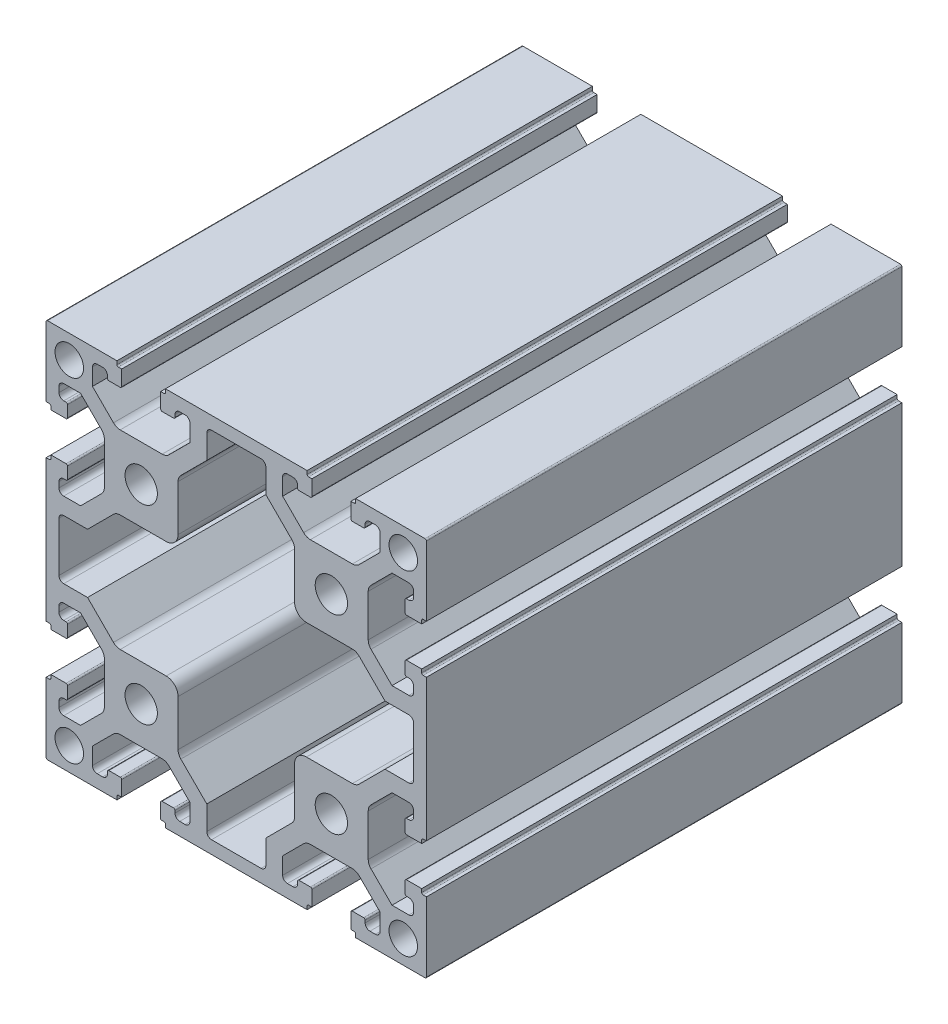
from build123d import *

# Parameters (mm, degrees)
SKETCH_1_R      = 3.4
SKETCH_1_R_2    = 3
EXTRUDE_1_DEPTH = 100


with BuildPart() as part:
    # 草图1 → 凸台-拉伸1 (new body)
    with BuildSketch(Plane.XY):
        with BuildLine():
            Line((-25.582808051, 38.637377279), (-40.182808051, 38.637377279))
            ThreePointArc((-40.182808051, 38.637377279), (-40.394940085, 38.549509313), (-40.482808051, 38.337377279))
            Line((-40.482808051, 38.337377279), (-40.482808051, 23.737377279))
            Line((-40.482808051, 23.737377279), (-39.782808051, 23.737377279))
            ThreePointArc((-39.782808051, 23.737377279), (-39.570676016, 23.649509313), (-39.482808051, 23.437377279))
            Line((-39.482808051, 23.437377279), (-39.482808051, 22.737377279))
            Line((-39.482808051, 22.737377279), (-36.282808051, 22.737377279))
            ThreePointArc((-36.282808051, 22.737377279), (-36.070676016, 22.825245245), (-35.982808051, 23.037377279))
            Line((-35.982808051, 23.037377279), (-35.982808051, 25.437377279))
            ThreePointArc((-35.982808051, 25.437377279), (-36.070676016, 25.649509313), (-36.282808051, 25.737377279))
            Line((-36.282808051, 25.737377279), (-36.782808051, 25.737377279))
            ThreePointArc((-36.782808051, 25.737377279), (-37.489914832, 26.030270498), (-37.782808051, 26.737377279))
            Line((-37.782808051, 26.737377279), (-37.782808051, 27.887377279))
            ThreePointArc((-37.782808051, 27.887377279), (-37.489914832, 28.59448406), (-36.782808051, 28.887377279))
            Line((-36.782808051, 28.887377279), (-33.235966056, 28.887377279))
            Line((-33.235966056, 28.887377279), (-28.818594488, 24.470005711))
            ThreePointArc((-28.818594488, 24.470005711), (-28.385048986, 23.821159014), (-28.232808051, 23.055792149))
            Line((-28.232808051, 23.055792149), (-28.232808051, 14.218962409))
            ThreePointArc((-28.232808051, 14.218962409), (-28.385048986, 13.453595545), (-28.818594488, 12.804748847))
            Line((-28.818594488, 12.804748847), (-33.235966056, 8.387377279))
            Line((-33.235966056, 8.387377279), (-36.782808051, 8.387377279))
            ThreePointArc((-36.782808051, 8.387377279), (-37.489914832, 8.680270498), (-37.782808051, 9.387377279))
            Line((-37.782808051, 9.387377279), (-37.782808051, 10.537377279))
            ThreePointArc((-37.782808051, 10.537377279), (-37.489914832, 11.24448406), (-36.782808051, 11.537377279))
            Line((-36.782808051, 11.537377279), (-36.282808051, 11.537377279))
            ThreePointArc((-36.282808051, 11.537377279), (-36.070676016, 11.625245245), (-35.982808051, 11.837377279))
            Line((-35.982808051, 11.837377279), (-35.982808051, 14.237377279))
            ThreePointArc((-35.982808051, 14.237377279), (-36.070676016, 14.449509313), (-36.282808051, 14.537377279))
            Line((-36.282808051, 14.537377279), (-39.482808051, 14.537377279))
            Line((-39.482808051, 14.537377279), (-39.482808051, 13.837377279))
            ThreePointArc((-39.482808051, 13.837377279), (-39.570676016, 13.625245245), (-39.782808051, 13.537377279))
            Line((-39.782808051, 13.537377279), (-40.482808051, 13.537377279))
            Line((-40.482808051, 13.537377279), (-40.482808051, 3.137377279))
            Line((-40.482808051, 3.137377279), (-40.482808051, -5.862622721))
            Line((-40.482808051, -5.862622721), (-40.482808051, -16.262622721))
            Line((-40.482808051, -16.262622721), (-39.782808051, -16.262622721))
            ThreePointArc((-39.782808051, -16.262622721), (-39.570676016, -16.350490687), (-39.482808051, -16.562622721))
            Line((-39.482808051, -16.562622721), (-39.482808051, -17.262622721))
            Line((-39.482808051, -17.262622721), (-36.282808051, -17.262622721))
            ThreePointArc((-36.282808051, -17.262622721), (-36.070676016, -17.174754755), (-35.982808051, -16.962622721))
            Line((-35.982808051, -16.962622721), (-35.982808051, -14.562622721))
            ThreePointArc((-35.982808051, -14.562622721), (-36.070676016, -14.350490687), (-36.282808051, -14.262622721))
            Line((-36.282808051, -14.262622721), (-36.782808051, -14.262622721))
            ThreePointArc((-36.782808051, -14.262622721), (-37.489914832, -13.969729502), (-37.782808051, -13.262622721))
            Line((-37.782808051, -13.262622721), (-37.782808051, -12.112622721))
            ThreePointArc((-37.782808051, -12.112622721), (-37.489914832, -11.40551594), (-36.782808051, -11.112622721))
            Line((-36.782808051, -11.112622721), (-33.235966056, -11.112622721))
            Line((-33.235966056, -11.112622721), (-28.818594488, -15.529994289))
            ThreePointArc((-28.818594488, -15.529994289), (-28.385048986, -16.178840986), (-28.232808051, -16.944207851))
            Line((-28.232808051, -16.944207851), (-28.232808051, -25.781037591))
            ThreePointArc((-28.232808051, -25.781037591), (-28.385048986, -26.546404455), (-28.818594488, -27.195251153))
            Line((-28.818594488, -27.195251153), (-33.235966056, -31.612622721))
            Line((-33.235966056, -31.612622721), (-36.782808051, -31.612622721))
            ThreePointArc((-36.782808051, -31.612622721), (-37.489914832, -31.319729502), (-37.782808051, -30.612622721))
            Line((-37.782808051, -30.612622721), (-37.782808051, -29.462622721))
            ThreePointArc((-37.782808051, -29.462622721), (-37.489914832, -28.75551594), (-36.782808051, -28.462622721))
            Line((-36.782808051, -28.462622721), (-36.282808051, -28.462622721))
            ThreePointArc((-36.282808051, -28.462622721), (-36.070676016, -28.374754755), (-35.982808051, -28.162622721))
            Line((-35.982808051, -28.162622721), (-35.982808051, -25.762622721))
            ThreePointArc((-35.982808051, -25.762622721), (-36.070676016, -25.550490687), (-36.282808051, -25.462622721))
            Line((-36.282808051, -25.462622721), (-39.482808051, -25.462622721))
            Line((-39.482808051, -25.462622721), (-39.482808051, -26.162622721))
            ThreePointArc((-39.482808051, -26.162622721), (-39.570676016, -26.374754755), (-39.782808051, -26.462622721))
            Line((-39.782808051, -26.462622721), (-40.482808051, -26.462622721))
            Line((-40.482808051, -26.462622721), (-40.482808051, -41.062622721))
            ThreePointArc((-40.482808051, -41.062622721), (-40.394940085, -41.274754755), (-40.182808051, -41.362622721))
            Line((-40.182808051, -41.362622721), (-25.582808051, -41.362622721))
            Line((-25.582808051, -41.362622721), (-25.582808051, -40.662622721))
            ThreePointArc((-25.582808051, -40.662622721), (-25.494940085, -40.450490687), (-25.282808051, -40.362622721))
            Line((-25.282808051, -40.362622721), (-24.582808051, -40.362622721))
            Line((-24.582808051, -40.362622721), (-24.582808051, -37.162622721))
            ThreePointArc((-24.582808051, -37.162622721), (-24.670676016, -36.950490687), (-24.882808051, -36.862622721))
            Line((-24.882808051, -36.862622721), (-27.282808051, -36.862622721))
            ThreePointArc((-27.282808051, -36.862622721), (-27.494940085, -36.950490687), (-27.582808051, -37.162622721))
            Line((-27.582808051, -37.162622721), (-27.582808051, -37.662622721))
            ThreePointArc((-27.582808051, -37.662622721), (-27.875701269, -38.369729502), (-28.582808051, -38.662622721))
            Line((-28.582808051, -38.662622721), (-29.732808051, -38.662622721))
            ThreePointArc((-29.732808051, -38.662622721), (-30.439914832, -38.369729502), (-30.732808051, -37.662622721))
            Line((-30.732808051, -37.662622721), (-30.732808051, -34.115780726))
            Line((-30.732808051, -34.115780726), (-26.315436483, -29.698409159))
            ThreePointArc((-26.315436483, -29.698409159), (-25.666589785, -29.264863656), (-24.90122292, -29.112622721))
            Line((-24.90122292, -29.112622721), (-16.064393181, -29.112622721))
            ThreePointArc((-16.064393181, -29.112622721), (-15.299026316, -29.264863656), (-14.650179618, -29.698409159))
            Line((-14.650179618, -29.698409159), (-10.232808051, -34.115780726))
            Line((-10.232808051, -34.115780726), (-10.232808051, -37.662622721))
            ThreePointArc((-10.232808051, -37.662622721), (-10.525701269, -38.369729502), (-11.232808051, -38.662622721))
            Line((-11.232808051, -38.662622721), (-12.382808051, -38.662622721))
            ThreePointArc((-12.382808051, -38.662622721), (-13.089914832, -38.369729502), (-13.382808051, -37.662622721))
            Line((-13.382808051, -37.662622721), (-13.382808051, -37.162622721))
            ThreePointArc((-13.382808051, -37.162622721), (-13.470676016, -36.950490687), (-13.682808051, -36.862622721))
            Line((-13.682808051, -36.862622721), (-16.082808051, -36.862622721))
            ThreePointArc((-16.082808051, -36.862622721), (-16.294940085, -36.950490687), (-16.382808051, -37.162622721))
            Line((-16.382808051, -37.162622721), (-16.382808051, -40.362622721))
            Line((-16.382808051, -40.362622721), (-15.682808051, -40.362622721))
            ThreePointArc((-15.682808051, -40.362622721), (-15.470676016, -40.450490687), (-15.382808051, -40.662622721))
            Line((-15.382808051, -40.662622721), (-15.382808051, -41.362622721))
            Line((-15.382808051, -41.362622721), (-4.982808051, -41.362622721))
            Line((-4.982808051, -41.362622721), (4.017191949, -41.362622721))
            Line((4.017191949, -41.362622721), (14.417191949, -41.362622721))
            Line((14.417191949, -41.362622721), (14.417191949, -40.662622721))
            ThreePointArc((14.417191949, -40.662622721), (14.505059915, -40.450490687), (14.717191949, -40.362622721))
            Line((14.717191949, -40.362622721), (15.417191949, -40.362622721))
            Line((15.417191949, -40.362622721), (15.417191949, -37.162622721))
            ThreePointArc((15.417191949, -37.162622721), (15.329323984, -36.950490687), (15.117191949, -36.862622721))
            Line((15.117191949, -36.862622721), (12.717191949, -36.862622721))
            ThreePointArc((12.717191949, -36.862622721), (12.505059915, -36.950490687), (12.417191949, -37.162622721))
            Line((12.417191949, -37.162622721), (12.417191949, -37.662622721))
            ThreePointArc((12.417191949, -37.662622721), (12.124298731, -38.369729502), (11.417191949, -38.662622721))
            Line((11.417191949, -38.662622721), (10.267191949, -38.662622721))
            ThreePointArc((10.267191949, -38.662622721), (9.560085168, -38.369729502), (9.267191949, -37.662622721))
            Line((9.267191949, -37.662622721), (9.267191949, -34.115780726))
            Line((9.267191949, -34.115780726), (13.684563517, -29.698409159))
            ThreePointArc((13.684563517, -29.698409159), (14.333410215, -29.264863656), (15.09877708, -29.112622721))
            Line((15.09877708, -29.112622721), (23.935606819, -29.112622721))
            ThreePointArc((23.935606819, -29.112622721), (24.700973684, -29.264863656), (25.349820382, -29.698409159))
            Line((25.349820382, -29.698409159), (29.767191949, -34.115780726))
            Line((29.767191949, -34.115780726), (29.767191949, -37.662622721))
            ThreePointArc((29.767191949, -37.662622721), (29.474298731, -38.369729502), (28.767191949, -38.662622721))
            Line((28.767191949, -38.662622721), (27.617191949, -38.662622721))
            ThreePointArc((27.617191949, -38.662622721), (26.910085168, -38.369729502), (26.617191949, -37.662622721))
            Line((26.617191949, -37.662622721), (26.617191949, -37.162622721))
            ThreePointArc((26.617191949, -37.162622721), (26.529323984, -36.950490687), (26.317191949, -36.862622721))
            Line((26.317191949, -36.862622721), (23.917191949, -36.862622721))
            ThreePointArc((23.917191949, -36.862622721), (23.705059915, -36.950490687), (23.617191949, -37.162622721))
            Line((23.617191949, -37.162622721), (23.617191949, -40.362622721))
            Line((23.617191949, -40.362622721), (24.317191949, -40.362622721))
            ThreePointArc((24.317191949, -40.362622721), (24.529323984, -40.450490687), (24.617191949, -40.662622721))
            Line((24.617191949, -40.662622721), (24.617191949, -41.362622721))
            Line((24.617191949, -41.362622721), (39.217191949, -41.362622721))
            ThreePointArc((39.217191949, -41.362622721), (39.429323984, -41.274754755), (39.517191949, -41.062622721))
            Line((39.517191949, -41.062622721), (39.517191949, -26.462622721))
            Line((39.517191949, -26.462622721), (38.817191949, -26.462622721))
            ThreePointArc((38.817191949, -26.462622721), (38.605059915, -26.374754755), (38.517191949, -26.162622721))
            Line((38.517191949, -26.162622721), (38.517191949, -25.462622721))
            Line((38.517191949, -25.462622721), (35.317191949, -25.462622721))
            ThreePointArc((35.317191949, -25.462622721), (35.105059915, -25.550490687), (35.017191949, -25.762622721))
            Line((35.017191949, -25.762622721), (35.017191949, -28.162622721))
            ThreePointArc((35.017191949, -28.162622721), (35.105059915, -28.374754755), (35.317191949, -28.462622721))
            Line((35.317191949, -28.462622721), (35.817191949, -28.462622721))
            ThreePointArc((35.817191949, -28.462622721), (36.524298731, -28.75551594), (36.817191949, -29.462622721))
            Line((36.817191949, -29.462622721), (36.817191949, -30.612622721))
            ThreePointArc((36.817191949, -30.612622721), (36.524298731, -31.319729502), (35.817191949, -31.612622721))
            Line((35.817191949, -31.612622721), (32.270349955, -31.612622721))
            Line((32.270349955, -31.612622721), (27.852978387, -27.195251153))
            ThreePointArc((27.852978387, -27.195251153), (27.419432884, -26.546404455), (27.267191949, -25.781037591))
            Line((27.267191949, -25.781037591), (27.267191949, -16.944207851))
            ThreePointArc((27.267191949, -16.944207851), (27.419432884, -16.178840986), (27.852978387, -15.529994289))
            Line((27.852978387, -15.529994289), (32.270349955, -11.112622721))
            Line((32.270349955, -11.112622721), (35.817191949, -11.112622721))
            ThreePointArc((35.817191949, -11.112622721), (36.524298731, -11.40551594), (36.817191949, -12.112622721))
            Line((36.817191949, -12.112622721), (36.817191949, -13.262622721))
            ThreePointArc((36.817191949, -13.262622721), (36.524298731, -13.969729502), (35.817191949, -14.262622721))
            Line((35.817191949, -14.262622721), (35.317191949, -14.262622721))
            ThreePointArc((35.317191949, -14.262622721), (35.105059915, -14.350490687), (35.017191949, -14.562622721))
            Line((35.017191949, -14.562622721), (35.017191949, -16.962622721))
            ThreePointArc((35.017191949, -16.962622721), (35.105059915, -17.174754755), (35.317191949, -17.262622721))
            Line((35.317191949, -17.262622721), (38.517191949, -17.262622721))
            Line((38.517191949, -17.262622721), (38.517191949, -16.562622721))
            ThreePointArc((38.517191949, -16.562622721), (38.605059915, -16.350490687), (38.817191949, -16.262622721))
            Line((38.817191949, -16.262622721), (39.517191949, -16.262622721))
            Line((39.517191949, -16.262622721), (39.517191949, -5.862622721))
            Line((39.517191949, -5.862622721), (39.517191949, 3.137377279))
            Line((39.517191949, 3.137377279), (39.517191949, 13.537377279))
            Line((39.517191949, 13.537377279), (38.817191949, 13.537377279))
            ThreePointArc((38.817191949, 13.537377279), (38.605059915, 13.625245245), (38.517191949, 13.837377279))
            Line((38.517191949, 13.837377279), (38.517191949, 14.537377279))
            Line((38.517191949, 14.537377279), (35.317191949, 14.537377279))
            ThreePointArc((35.317191949, 14.537377279), (35.105059915, 14.449509313), (35.017191949, 14.237377279))
            Line((35.017191949, 14.237377279), (35.017191949, 11.837377279))
            ThreePointArc((35.017191949, 11.837377279), (35.105059915, 11.625245245), (35.317191949, 11.537377279))
            Line((35.317191949, 11.537377279), (35.817191949, 11.537377279))
            ThreePointArc((35.817191949, 11.537377279), (36.524298731, 11.24448406), (36.817191949, 10.537377279))
            Line((36.817191949, 10.537377279), (36.817191949, 9.387377279))
            ThreePointArc((36.817191949, 9.387377279), (36.524298731, 8.680270498), (35.817191949, 8.387377279))
            Line((35.817191949, 8.387377279), (32.270349955, 8.387377279))
            Line((32.270349955, 8.387377279), (27.852978387, 12.804748847))
            ThreePointArc((27.852978387, 12.804748847), (27.419432884, 13.453595545), (27.267191949, 14.218962409))
            Line((27.267191949, 14.218962409), (27.267191949, 23.055792149))
            ThreePointArc((27.267191949, 23.055792149), (27.419432884, 23.821159014), (27.852978387, 24.470005711))
            Line((27.852978387, 24.470005711), (32.270349955, 28.887377279))
            Line((32.270349955, 28.887377279), (35.817191949, 28.887377279))
            ThreePointArc((35.817191949, 28.887377279), (36.524298731, 28.59448406), (36.817191949, 27.887377279))
            Line((36.817191949, 27.887377279), (36.817191949, 26.737377279))
            ThreePointArc((36.817191949, 26.737377279), (36.524298731, 26.030270498), (35.817191949, 25.737377279))
            Line((35.817191949, 25.737377279), (35.317191949, 25.737377279))
            ThreePointArc((35.317191949, 25.737377279), (35.105059915, 25.649509313), (35.017191949, 25.437377279))
            Line((35.017191949, 25.437377279), (35.017191949, 23.037377279))
            ThreePointArc((35.017191949, 23.037377279), (35.105059915, 22.825245245), (35.317191949, 22.737377279))
            Line((35.317191949, 22.737377279), (38.517191949, 22.737377279))
            Line((38.517191949, 22.737377279), (38.517191949, 23.437377279))
            ThreePointArc((38.517191949, 23.437377279), (38.605059915, 23.649509313), (38.817191949, 23.737377279))
            Line((38.817191949, 23.737377279), (39.517191949, 23.737377279))
            Line((39.517191949, 23.737377279), (39.517191949, 38.337377279))
            ThreePointArc((39.517191949, 38.337377279), (39.429323984, 38.549509313), (39.217191949, 38.637377279))
            Line((39.217191949, 38.637377279), (24.617191949, 38.637377279))
            Line((24.617191949, 38.637377279), (24.617191949, 37.937377279))
            ThreePointArc((24.617191949, 37.937377279), (24.529323984, 37.725245245), (24.317191949, 37.637377279))
            Line((24.317191949, 37.637377279), (23.617191949, 37.637377279))
            Line((23.617191949, 37.637377279), (23.617191949, 34.437377279))
            ThreePointArc((23.617191949, 34.437377279), (23.705059915, 34.225245245), (23.917191949, 34.137377279))
            Line((23.917191949, 34.137377279), (26.317191949, 34.137377279))
            ThreePointArc((26.317191949, 34.137377279), (26.529323984, 34.225245245), (26.617191949, 34.437377279))
            Line((26.617191949, 34.437377279), (26.617191949, 34.937377279))
            ThreePointArc((26.617191949, 34.937377279), (26.910085168, 35.64448406), (27.617191949, 35.937377279))
            Line((27.617191949, 35.937377279), (28.767191949, 35.937377279))
            ThreePointArc((28.767191949, 35.937377279), (29.474298731, 35.64448406), (29.767191949, 34.937377279))
            Line((29.767191949, 34.937377279), (29.767191949, 31.390535285))
            Line((29.767191949, 31.390535285), (25.349820382, 26.973163717))
            ThreePointArc((25.349820382, 26.973163717), (24.700973684, 26.539618214), (23.935606819, 26.387377279))
            Line((23.935606819, 26.387377279), (15.09877708, 26.387377279))
            ThreePointArc((15.09877708, 26.387377279), (14.333410215, 26.539618214), (13.684563517, 26.973163717))
            Line((13.684563517, 26.973163717), (9.267191949, 31.390535285))
            Line((9.267191949, 31.390535285), (9.267191949, 34.937377279))
            ThreePointArc((9.267191949, 34.937377279), (9.560085168, 35.64448406), (10.267191949, 35.937377279))
            Line((10.267191949, 35.937377279), (11.417191949, 35.937377279))
            ThreePointArc((11.417191949, 35.937377279), (12.124298731, 35.64448406), (12.417191949, 34.937377279))
            Line((12.417191949, 34.937377279), (12.417191949, 34.437377279))
            ThreePointArc((12.417191949, 34.437377279), (12.505059915, 34.225245245), (12.717191949, 34.137377279))
            Line((12.717191949, 34.137377279), (15.117191949, 34.137377279))
            ThreePointArc((15.117191949, 34.137377279), (15.329323984, 34.225245245), (15.417191949, 34.437377279))
            Line((15.417191949, 34.437377279), (15.417191949, 37.637377279))
            Line((15.417191949, 37.637377279), (14.717191949, 37.637377279))
            ThreePointArc((14.717191949, 37.637377279), (14.505059915, 37.725245245), (14.417191949, 37.937377279))
            Line((14.417191949, 37.937377279), (14.417191949, 38.637377279))
            Line((14.417191949, 38.637377279), (4.017191949, 38.637377279))
            Line((4.017191949, 38.637377279), (-4.982808051, 38.637377279))
            Line((-4.982808051, 38.637377279), (-15.382808051, 38.637377279))
            Line((-15.382808051, 38.637377279), (-15.382808051, 37.937377279))
            ThreePointArc((-15.382808051, 37.937377279), (-15.470676016, 37.725245245), (-15.682808051, 37.637377279))
            Line((-15.682808051, 37.637377279), (-16.382808051, 37.637377279))
            Line((-16.382808051, 37.637377279), (-16.382808051, 34.437377279))
            ThreePointArc((-16.382808051, 34.437377279), (-16.294940085, 34.225245245), (-16.082808051, 34.137377279))
            Line((-16.082808051, 34.137377279), (-13.682808051, 34.137377279))
            ThreePointArc((-13.682808051, 34.137377279), (-13.470676016, 34.225245245), (-13.382808051, 34.437377279))
            Line((-13.382808051, 34.437377279), (-13.382808051, 34.937377279))
            ThreePointArc((-13.382808051, 34.937377279), (-13.089914832, 35.64448406), (-12.382808051, 35.937377279))
            Line((-12.382808051, 35.937377279), (-11.232808051, 35.937377279))
            ThreePointArc((-11.232808051, 35.937377279), (-10.525701269, 35.64448406), (-10.232808051, 34.937377279))
            Line((-10.232808051, 34.937377279), (-10.232808051, 31.390535285))
            Line((-10.232808051, 31.390535285), (-14.650179618, 26.973163717))
            ThreePointArc((-14.650179618, 26.973163717), (-15.299026316, 26.539618214), (-16.064393181, 26.387377279))
            Line((-16.064393181, 26.387377279), (-24.90122292, 26.387377279))
            ThreePointArc((-24.90122292, 26.387377279), (-25.666589785, 26.539618214), (-26.315436483, 26.973163717))
            Line((-26.315436483, 26.973163717), (-30.732808051, 31.390535285))
            Line((-30.732808051, 31.390535285), (-30.732808051, 34.937377279))
            ThreePointArc((-30.732808051, 34.937377279), (-30.439914832, 35.64448406), (-29.732808051, 35.937377279))
            Line((-29.732808051, 35.937377279), (-28.582808051, 35.937377279))
            ThreePointArc((-28.582808051, 35.937377279), (-27.875701269, 35.64448406), (-27.582808051, 34.937377279))
            Line((-27.582808051, 34.937377279), (-27.582808051, 34.437377279))
            ThreePointArc((-27.582808051, 34.437377279), (-27.494940085, 34.225245245), (-27.282808051, 34.137377279))
            Line((-27.282808051, 34.137377279), (-24.882808051, 34.137377279))
            ThreePointArc((-24.882808051, 34.137377279), (-24.670676016, 34.225245245), (-24.582808051, 34.437377279))
            Line((-24.582808051, 34.437377279), (-24.582808051, 37.637377279))
            Line((-24.582808051, 37.637377279), (-25.282808051, 37.637377279))
            ThreePointArc((-25.282808051, 37.637377279), (-25.494940085, 37.725245245), (-25.582808051, 37.937377279))
            Line((-25.582808051, 37.937377279), (-25.582808051, 38.637377279))
        make_face()
        with Locations((-20.482808051, 18.637377279)):
            Circle(SKETCH_1_R, mode=Mode.SUBTRACT)
        with Locations((-35.607808051, 33.762377279)):
            Circle(SKETCH_1_R_2, mode=Mode.SUBTRACT)
        with Locations((19.517191949, 18.637377279)):
            Circle(SKETCH_1_R, mode=Mode.SUBTRACT)
        with Locations((34.642191949, 33.762377279)):
            Circle(SKETCH_1_R_2, mode=Mode.SUBTRACT)
        with Locations((-20.482808051, -21.362622721)):
            Circle(SKETCH_1_R, mode=Mode.SUBTRACT)
        with Locations((-35.607808051, -36.487622721)):
            Circle(SKETCH_1_R_2, mode=Mode.SUBTRACT)
        with Locations((19.517191949, -21.362622721)):
            Circle(SKETCH_1_R, mode=Mode.SUBTRACT)
        with Locations((34.642191949, -36.487622721)):
            Circle(SKETCH_1_R_2, mode=Mode.SUBTRACT)
        with BuildLine():
            Line((-31.769650045, 4.847377279), (-26.315436483, 10.301590841))
            ThreePointArc((-26.315436483, 10.301590841), (-25.666589785, 10.735136344), (-24.90122292, 10.887377279))
            Line((-24.90122292, 10.887377279), (-15.232808051, 10.887377279))
            ThreePointArc((-15.232808051, 10.887377279), (-13.465041098, 11.619610326), (-12.732808051, 13.387377279))
            Line((-12.732808051, 13.387377279), (-12.732808051, 23.055792149))
            ThreePointArc((-12.732808051, 23.055792149), (-12.580567116, 23.821159014), (-12.147021613, 24.470005711))
            Line((-12.147021613, 24.470005711), (-6.692808051, 29.924219274))
            Line((-6.692808051, 29.924219274), (-6.692808051, 34.937377279))
            ThreePointArc((-6.692808051, 34.937377279), (-6.399914832, 35.64448406), (-5.692808051, 35.937377279))
            Line((-5.692808051, 35.937377279), (4.727191949, 35.937377279))
            ThreePointArc((4.727191949, 35.937377279), (5.434298731, 35.64448406), (5.727191949, 34.937377279))
            Line((5.727191949, 34.937377279), (5.727191949, 29.924219274))
            Line((5.727191949, 29.924219274), (11.181405512, 24.470005711))
            ThreePointArc((11.181405512, 24.470005711), (11.614951014, 23.821159014), (11.767191949, 23.055792149))
            Line((11.767191949, 23.055792149), (11.767191949, 13.387377279))
            ThreePointArc((11.767191949, 13.387377279), (12.499424997, 11.619610326), (14.267191949, 10.887377279))
            Line((14.267191949, 10.887377279), (23.935606819, 10.887377279))
            ThreePointArc((23.935606819, 10.887377279), (24.700973684, 10.735136344), (25.349820382, 10.301590841))
            Line((25.349820382, 10.301590841), (30.804033944, 4.847377279))
            Line((30.804033944, 4.847377279), (35.817191949, 4.847377279))
            ThreePointArc((35.817191949, 4.847377279), (36.524298731, 4.55448406), (36.817191949, 3.847377279))
            Line((36.817191949, 3.847377279), (36.817191949, -6.572622721))
            ThreePointArc((36.817191949, -6.572622721), (36.524298731, -7.279729502), (35.817191949, -7.572622721))
            Line((35.817191949, -7.572622721), (30.804033944, -7.572622721))
            Line((30.804033944, -7.572622721), (25.349820382, -13.026836283))
            ThreePointArc((25.349820382, -13.026836283), (24.700973684, -13.460381786), (23.935606819, -13.612622721))
            Line((23.935606819, -13.612622721), (14.267191949, -13.612622721))
            ThreePointArc((14.267191949, -13.612622721), (12.499424997, -14.344855768), (11.767191949, -16.112622721))
            Line((11.767191949, -16.112622721), (11.767191949, -25.781037591))
            ThreePointArc((11.767191949, -25.781037591), (11.614951014, -26.546404455), (11.181405512, -27.195251153))
            Line((11.181405512, -27.195251153), (5.727191949, -32.649464715))
            Line((5.727191949, -32.649464715), (5.727191949, -37.662622721))
            ThreePointArc((5.727191949, -37.662622721), (5.434298731, -38.369729502), (4.727191949, -38.662622721))
            Line((4.727191949, -38.662622721), (-5.692808051, -38.662622721))
            ThreePointArc((-5.692808051, -38.662622721), (-6.399914832, -38.369729502), (-6.692808051, -37.662622721))
            Line((-6.692808051, -37.662622721), (-6.692808051, -32.649464715))
            Line((-6.692808051, -32.649464715), (-12.147021613, -27.195251153))
            ThreePointArc((-12.147021613, -27.195251153), (-12.580567116, -26.546404455), (-12.732808051, -25.781037591))
            Line((-12.732808051, -25.781037591), (-12.732808051, -16.112622721))
            ThreePointArc((-12.732808051, -16.112622721), (-13.465041098, -14.344855768), (-15.232808051, -13.612622721))
            Line((-15.232808051, -13.612622721), (-24.90122292, -13.612622721))
            ThreePointArc((-24.90122292, -13.612622721), (-25.666589785, -13.460381786), (-26.315436483, -13.026836283))
            Line((-26.315436483, -13.026836283), (-31.769650045, -7.572622721))
            Line((-31.769650045, -7.572622721), (-36.782808051, -7.572622721))
            ThreePointArc((-36.782808051, -7.572622721), (-37.489914832, -7.279729502), (-37.782808051, -6.572622721))
            Line((-37.782808051, -6.572622721), (-37.782808051, 3.847377279))
            ThreePointArc((-37.782808051, 3.847377279), (-37.489914832, 4.55448406), (-36.782808051, 4.847377279))
            Line((-36.782808051, 4.847377279), (-31.769650045, 4.847377279))
        make_face(mode=Mode.SUBTRACT)
    extrude(amount=EXTRUDE_1_DEPTH)


solid = part.part
